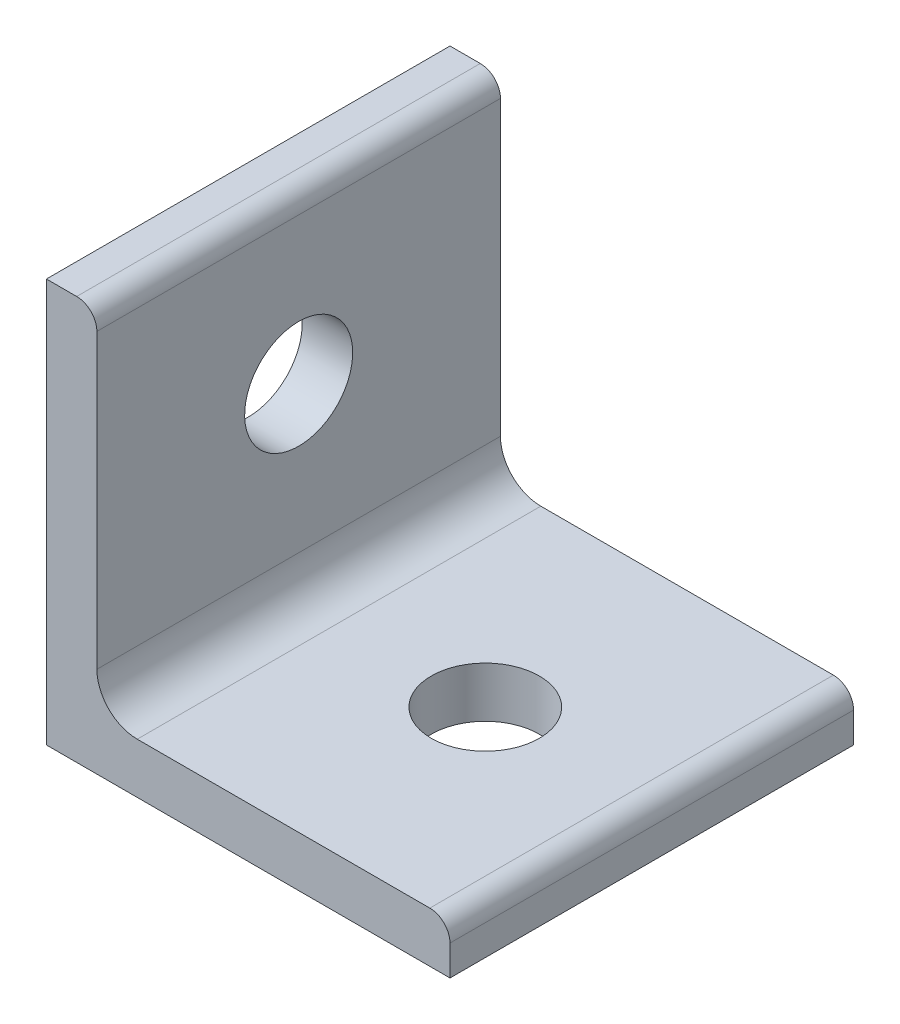
from build123d import *

# Parameters (mm, degrees)
BOSS_EXTRUDE1_DEPTH = 12.7
FILLET1_R           = 1.27
FILLET2_R           = 0.635
SKETCH2_R           = 1.7
CUT_EXTRUDE1_DEPTH  = 22.120313829
SKETCH3_R           = 1.7
CUT_EXTRUDE2_DEPTH  = 22.120313829


with BuildPart() as part:
    # Sketch1 → Boss-Extrude1 (new body)
    with BuildSketch(Plane.XY):
        Polygon((0, 0), (0, 12.7), (1.5875, 12.7), (1.5875, 1.5875), (12.7, 1.5875), (12.7, 0), align=None)
    extrude(amount=BOSS_EXTRUDE1_DEPTH)

    # Fillet1
    fillet1_edges = [part.edges().sort_by_distance(p)[0] for p in [
        (1.5875, 1.5875, 6.35),
    ]]
    fillet(fillet1_edges, radius=FILLET1_R)

    # Fillet2
    fillet2_edges = [part.edges().sort_by_distance(p)[0] for p in [
        (1.5875, 12.7, 6.35),
        (12.7, 1.5875, 6.35),
    ]]
    fillet(fillet2_edges, radius=FILLET2_R)

    # Sketch2 → Cut-Extrude1 (cut, through all)
    with BuildSketch(Plane(origin=(1.5875, 0, 0), x_dir=(0, 0, -1), z_dir=(1, 0, 0))):
        with Locations(Location((-6.35, 7.46125, 0), (0, 0, 90))):
            Circle(SKETCH2_R)
    extrude(amount=-CUT_EXTRUDE1_DEPTH, mode=Mode.SUBTRACT)

    # Sketch3 → Cut-Extrude2 (cut, through all)
    with BuildSketch(Plane(origin=(0, 1.5875, 0), x_dir=(1, 0, 0), z_dir=(0, 1, 0))):
        with Locations(Location((7.46125, -6.35, 0), (0, 0, 270))):
            Circle(SKETCH3_R)
    extrude(amount=-CUT_EXTRUDE2_DEPTH, mode=Mode.SUBTRACT)


solid = part.part
